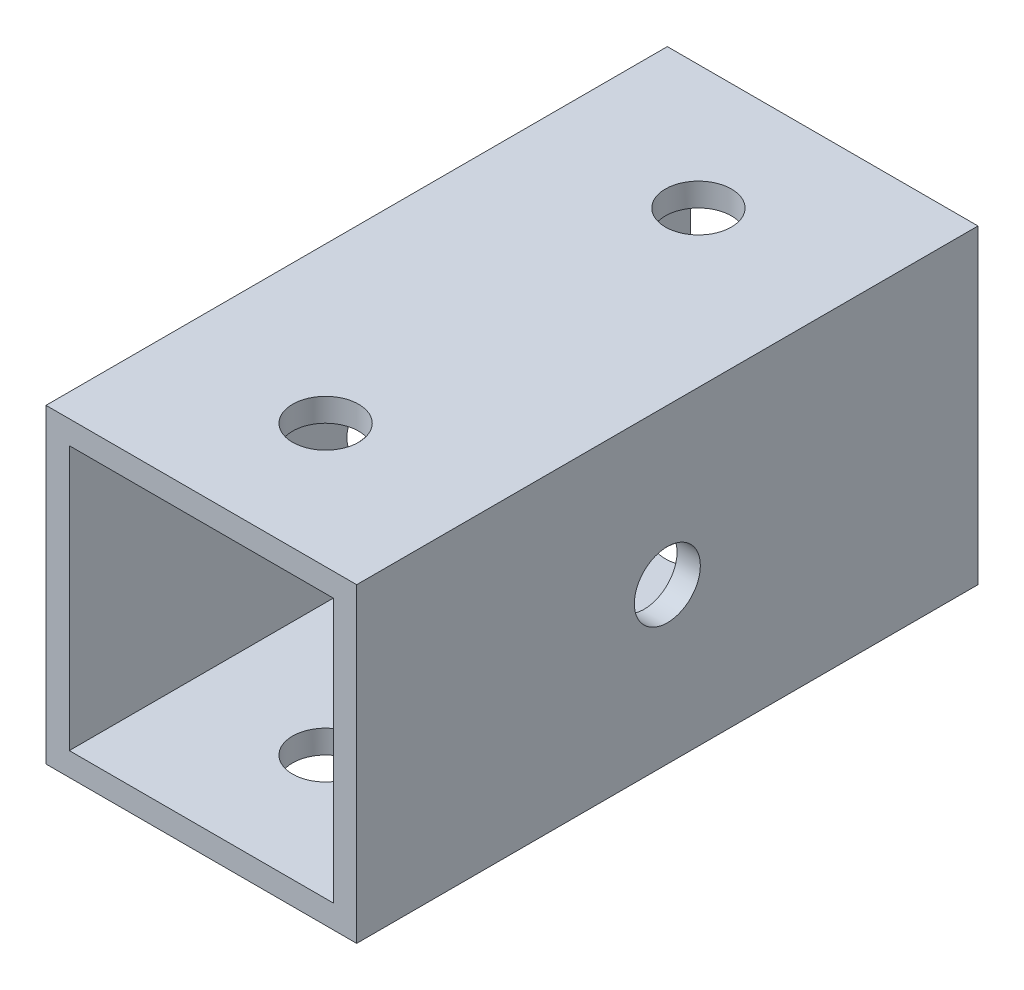
from build123d import *

# Parameters (mm, degrees)
SKETCH1_W           = 20
SKETCH1_H           = 20
SKETCH1_W_2         = 17
SKETCH1_H_2         = 17
BOSS_EXTRUDE1_DEPTH = 40
SKETCH2_R           = 2.125
CUT_EXTRUDE1_DEPTH  = 46.82575695
SKETCH3_R           = 2.125
CUT_EXTRUDE2_DEPTH  = 46.82575695


with BuildPart() as part:
    # Sketch1 → Boss-Extrude1 (new body)
    with BuildSketch(Plane.XY):
        Rectangle(SKETCH1_W, SKETCH1_H)
        Rectangle(SKETCH1_W_2, SKETCH1_H_2, mode=Mode.SUBTRACT)
    extrude(amount=-BOSS_EXTRUDE1_DEPTH)

    # Sketch2 → Cut-Extrude1 (cut, through all)
    with BuildSketch(Plane(origin=(0, 10, 0), x_dir=(1, 0, 0), z_dir=(0, 1, 0))):
        with Locations(Location((0, 8, 0), (0, 0, 270))):
            Circle(SKETCH2_R)
        with Locations(Location((0, 32, 0), (0, 0, 90))):
            Circle(SKETCH2_R)
    extrude(amount=-CUT_EXTRUDE1_DEPTH, mode=Mode.SUBTRACT)

    # Sketch3 → Cut-Extrude2 (cut, through all)
    with BuildSketch(Plane(origin=(10, 0, 0), x_dir=(0, 0, -1), z_dir=(1, 0, 0))):
        with Locations((20, 0)):
            Circle(SKETCH3_R)
    extrude(amount=-CUT_EXTRUDE2_DEPTH, mode=Mode.SUBTRACT)


solid = part.part
